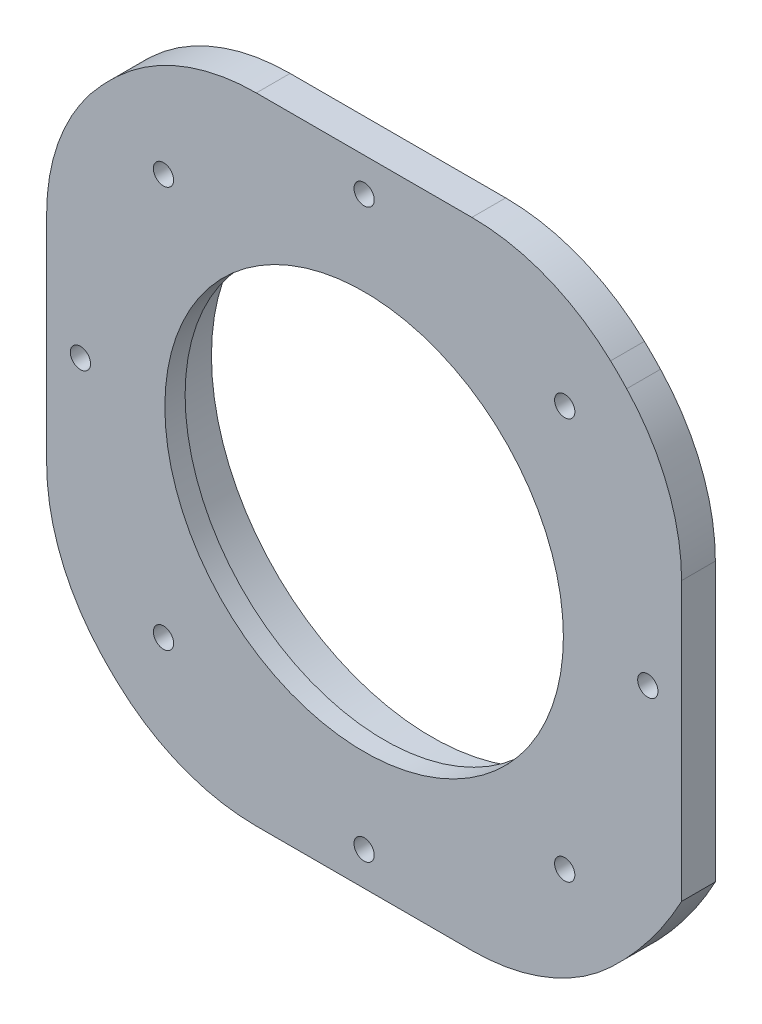
from build123d import *

# Parameters (mm, degrees)
SKETCH1_R               = 36
BOSS_EXTRUDE1_DEPTH     = 5
BOSS_EXTRUDE2_START     = -5
BOSS_EXTRUDE2_DEPTH     = 5
BOSS_EXTRUDE3_START     = -5
BOSS_EXTRUDE3_DEPTH     = 5
BOSS_EXTRUDE4_START     = 5
SKETCH3_R               = 32.7
SKETCH3_R_2             = 32.6
BOSS_EXTRUDE4_DEPTH     = 5
CUT_EXTRUDE1_DEPTH      = 68.216069507
CUT_EXTRUDE1_DEPTH_BACK = 68.216069507
SKETCH4_R               = 32.6
BOSS_EXTRUDE5_START     = -3
SKETCH5_R               = 29.5
BOSS_EXTRUDE5_DEPTH     = 3
CUT_EXTRUDE3_DEPTH      = 68.216069507
CUT_EXTRUDE3_DEPTH_BACK = 68.216069507
SKETCH6_R               = 1.5


with BuildPart() as part:
    # Sketch1 → Boss-Extrude1 (new body)
    # profile 1 of 3: a face of its own
    with BuildSketch(Plane.XY):
        with BuildLine():
            Line((15.957693357, 47), (-15.957693357, 47))
            ThreePointArc((-15.957693357, 47), (-26.99865268, 44.894394011), (-36.489751331, 38.873147815))
            ThreePointArc((-36.489751331, 38.873147815), (-37.700288946, 37.700288946), (-38.873147815, 36.489751331))
            ThreePointArc((-38.873147815, 36.489751331), (-44.894394011, 26.99865268), (-47, 15.957693357))
            Line((-47, 15.957693357), (-47, -15.957693357))
            ThreePointArc((-47, -15.957693357), (-44.894394011, -26.99865268), (-38.873147815, -36.489751331))
            ThreePointArc((-38.873147815, -36.489751331), (-37.700288946, -37.700288946), (-36.489751331, -38.873147815))
            ThreePointArc((-36.489751331, -38.873147815), (-26.99865268, -44.894394011), (-15.957693357, -47))
            Line((-15.957693357, -47), (15.957693357, -47))
            ThreePointArc((15.957693357, -47), (26.99865268, -44.894394011), (36.489751331, -38.873147815))
            ThreePointArc((36.489751331, -38.873147815), (42.303260219, -32.45085127), (47, -25.171880606))
            Line((47, -25.171880606), (47, 15.957693357))
            ThreePointArc((47, 15.957693357), (44.894394011, 26.99865268), (38.873147815, 36.489751331))
            ThreePointArc((38.873147815, 36.489751331), (37.700288946, 37.700288946), (36.489751331, 38.873147815))
            ThreePointArc((36.489751331, 38.873147815), (26.99865268, 44.894394011), (15.957693357, 47))
        make_face()
        Circle(SKETCH1_R, mode=Mode.SUBTRACT)
    # profile 2 of 3: a face of its own
    with BuildSketch(Plane.XY):
        with BuildLine():
            ThreePointArc((35.529282793, -5.802591166), (35.882127728, -2.910826297), (36, 0))
            ThreePointArc((36, 0), (35.999320343, 0.221212273), (35.997281396, 0.442416194))
            ThreePointArc((35.997281396, 0.442416194), (33.655628155, 2.522140659), (35.661160217, 4.927641625))
            ThreePointArc((35.661160217, 4.927641625), (35.097404839, 8.010753622), (34.267618722, 11.03314584))
            ThreePointArc((34.267618722, 11.03314584), (31.416989017, 12.330259572), (32.62438706, 15.220031833))
            ThreePointArc((32.62438706, 15.220031833), (31.176914536, 18), (29.493127743, 20.64353206))
            ThreePointArc((29.493127743, 20.64353206), (26.386812533, 21.042780813), (26.688793942, 24.16005542))
            ThreePointArc((26.688793942, 24.16005542), (24.48621856, 26.389867386), (22.098042936, 28.419649864))
            ThreePointArc((22.098042936, 28.419649864), (19.01205196, 27.885558633), (18.381784361, 30.953352059))
            ThreePointArc((18.381784361, 30.953352059), (15.619814608, 32.434879244), (12.739450039, 33.67055706))
            ThreePointArc((12.739450039, 33.67055706), (9.947987136, 32.250582195), (8.441472573, 34.996307531))
            ThreePointArc((8.441472573, 34.996307531), (5.365521582, 35.597909744), (2.248901099, 35.9296875))
            ThreePointArc((2.248901099, 35.9296875), (0, 33.75), (-2.248901099, 35.9296875))
            ThreePointArc((-2.248901099, 35.9296875), (-5.365521582, 35.597909744), (-8.441472573, 34.996307531))
            ThreePointArc((-8.441472573, 34.996307531), (-9.947987136, 32.250582195), (-12.739450039, 33.67055706))
            ThreePointArc((-12.739450039, 33.67055706), (-15.619814608, 32.434879244), (-18.381784361, 30.953352059))
            ThreePointArc((-18.381784361, 30.953352059), (-19.01205196, 27.885558633), (-22.098042936, 28.419649864))
            ThreePointArc((-22.098042936, 28.419649864), (-24.48621856, 26.389867386), (-26.688793942, 24.16005542))
            ThreePointArc((-26.688793942, 24.16005542), (-26.386812533, 21.042780813), (-29.493127743, 20.64353206))
            ThreePointArc((-29.493127743, 20.64353206), (-31.176914536, 18), (-32.62438706, 15.220031833))
            ThreePointArc((-32.62438706, 15.220031833), (-31.416989017, 12.330259572), (-34.267618722, 11.03314584))
            ThreePointArc((-34.267618722, 11.03314584), (-35.097404839, 8.010753622), (-35.661160217, 4.927641625))
            ThreePointArc((-35.661160217, 4.927641625), (-33.655628155, 2.522140659), (-35.997281396, 0.442416194))
            ThreePointArc((-35.997281396, 0.442416194), (-35.899336699, -2.690283369), (-35.529282793, -5.802591166))
            ThreePointArc((-35.529282793, -5.802591166), (-32.903817036, -7.510081521), (-34.528427647, -10.187624072))
            ThreePointArc((-34.528427647, -10.187624072), (-33.511454951, -13.152276877), (-32.240472674, -16.017238268))
            ThreePointArc((-32.240472674, -16.017238268), (-29.228357378, -16.875), (-29.991571576, -19.912449232))
            ThreePointArc((-29.991571576, -19.912449232), (-28.145933369, -22.445632867), (-26.086955074, -24.808683459))
            ThreePointArc((-26.086955074, -24.808683459), (-22.9558299, -24.740500674), (-22.789832754, -27.867965894))
            ThreePointArc((-22.789832754, -27.867965894), (-20.27952209, -29.744595875), (-17.615497035, -31.395768253))
            ThreePointArc((-17.615497035, -31.395768253), (-14.643576195, -30.407699292), (-13.563117281, -33.347291489))
            ThreePointArc((-13.563117281, -33.347291489), (-10.611186279, -34.400621008), (-7.57882478, -35.19320126))
            ThreePointArc((-7.57882478, -35.19320126), (-5.030176483, -33.373040385), (-3.131259316, -35.863563893))
            ThreePointArc((-3.131259316, -35.863563893), (0, -36), (3.131259316, -35.863563893))
            ThreePointArc((3.131259316, -35.863563893), (5.030176483, -33.373040385), (7.57882478, -35.19320126))
            ThreePointArc((7.57882478, -35.19320126), (10.611186279, -34.400621008), (13.563117281, -33.347291489))
            ThreePointArc((13.563117281, -33.347291489), (14.643576195, -30.407699292), (17.615497035, -31.395768253))
            ThreePointArc((17.615497035, -31.395768253), (20.27952209, -29.744595875), (22.789832754, -27.867965894))
            ThreePointArc((22.789832754, -27.867965894), (22.9558299, -24.740500674), (26.086955074, -24.808683459))
            ThreePointArc((26.086955074, -24.808683459), (28.145933369, -22.445632867), (29.991571576, -19.912449232))
            ThreePointArc((29.991571576, -19.912449232), (29.228357378, -16.875), (32.240472674, -16.017238268))
            ThreePointArc((32.240472674, -16.017238268), (33.511454951, -13.152276877), (34.528427647, -10.187624072))
            ThreePointArc((34.528427647, -10.187624072), (32.903817036, -7.510081521), (35.529282793, -5.802591166))
        make_face()
        with BuildLine():
            ThreePointArc((-32.7, 0), (0, 32.7), (32.7, 0))
            ThreePointArc((32.7, 0), (0, -32.7), (-32.7, 0))
        make_face(mode=Mode.SUBTRACT)
    # profile 3 of 3: a face of its own
    with BuildSketch(Plane.XY):
        with BuildLine():
            ThreePointArc((32.7, 0), (0, 32.7), (-32.7, 0))
            ThreePointArc((-32.7, 0), (0, -32.7), (32.7, 0))
        make_face()
    extrude(amount=BOSS_EXTRUDE1_DEPTH)

    # Sketch1<4> → Boss-Extrude2 (add)
    with BuildSketch(Plane.XY.offset(BOSS_EXTRUDE2_START)):
        with BuildLine():
            ThreePointArc((35.529282793, -5.802591166), (35.882127728, -2.910826297), (36, 0))
            ThreePointArc((36, 0), (35.999320343, 0.221212273), (35.997281396, 0.442416194))
            ThreePointArc((35.997281396, 0.442416194), (33.655628155, 2.522140659), (35.661160217, 4.927641625))
            ThreePointArc((35.661160217, 4.927641625), (35.097404839, 8.010753622), (34.267618722, 11.03314584))
            ThreePointArc((34.267618722, 11.03314584), (31.416989017, 12.330259572), (32.62438706, 15.220031833))
            ThreePointArc((32.62438706, 15.220031833), (31.176914536, 18), (29.493127743, 20.64353206))
            ThreePointArc((29.493127743, 20.64353206), (26.386812533, 21.042780813), (26.688793942, 24.16005542))
            ThreePointArc((26.688793942, 24.16005542), (24.48621856, 26.389867386), (22.098042936, 28.419649864))
            ThreePointArc((22.098042936, 28.419649864), (19.01205196, 27.885558633), (18.381784361, 30.953352059))
            ThreePointArc((18.381784361, 30.953352059), (15.619814608, 32.434879244), (12.739450039, 33.67055706))
            ThreePointArc((12.739450039, 33.67055706), (9.947987136, 32.250582195), (8.441472573, 34.996307531))
            ThreePointArc((8.441472573, 34.996307531), (5.365521582, 35.597909744), (2.248901099, 35.9296875))
            ThreePointArc((2.248901099, 35.9296875), (0, 33.75), (-2.248901099, 35.9296875))
            ThreePointArc((-2.248901099, 35.9296875), (-5.365521582, 35.597909744), (-8.441472573, 34.996307531))
            ThreePointArc((-8.441472573, 34.996307531), (-9.947987136, 32.250582195), (-12.739450039, 33.67055706))
            ThreePointArc((-12.739450039, 33.67055706), (-15.619814608, 32.434879244), (-18.381784361, 30.953352059))
            ThreePointArc((-18.381784361, 30.953352059), (-19.01205196, 27.885558633), (-22.098042936, 28.419649864))
            ThreePointArc((-22.098042936, 28.419649864), (-24.48621856, 26.389867386), (-26.688793942, 24.16005542))
            ThreePointArc((-26.688793942, 24.16005542), (-26.386812533, 21.042780813), (-29.493127743, 20.64353206))
            ThreePointArc((-29.493127743, 20.64353206), (-31.176914536, 18), (-32.62438706, 15.220031833))
            ThreePointArc((-32.62438706, 15.220031833), (-31.416989017, 12.330259572), (-34.267618722, 11.03314584))
            ThreePointArc((-34.267618722, 11.03314584), (-35.097404839, 8.010753622), (-35.661160217, 4.927641625))
            ThreePointArc((-35.661160217, 4.927641625), (-33.655628155, 2.522140659), (-35.997281396, 0.442416194))
            ThreePointArc((-35.997281396, 0.442416194), (-35.899336699, -2.690283369), (-35.529282793, -5.802591166))
            ThreePointArc((-35.529282793, -5.802591166), (-32.903817036, -7.510081521), (-34.528427647, -10.187624072))
            ThreePointArc((-34.528427647, -10.187624072), (-33.511454951, -13.152276877), (-32.240472674, -16.017238268))
            ThreePointArc((-32.240472674, -16.017238268), (-29.228357378, -16.875), (-29.991571576, -19.912449232))
            ThreePointArc((-29.991571576, -19.912449232), (-28.145933369, -22.445632867), (-26.086955074, -24.808683459))
            ThreePointArc((-26.086955074, -24.808683459), (-22.9558299, -24.740500674), (-22.789832754, -27.867965894))
            ThreePointArc((-22.789832754, -27.867965894), (-20.27952209, -29.744595875), (-17.615497035, -31.395768253))
            ThreePointArc((-17.615497035, -31.395768253), (-14.643576195, -30.407699292), (-13.563117281, -33.347291489))
            ThreePointArc((-13.563117281, -33.347291489), (-10.611186279, -34.400621008), (-7.57882478, -35.19320126))
            ThreePointArc((-7.57882478, -35.19320126), (-5.030176483, -33.373040385), (-3.131259316, -35.863563893))
            ThreePointArc((-3.131259316, -35.863563893), (0, -36), (3.131259316, -35.863563893))
            ThreePointArc((3.131259316, -35.863563893), (5.030176483, -33.373040385), (7.57882478, -35.19320126))
            ThreePointArc((7.57882478, -35.19320126), (10.611186279, -34.400621008), (13.563117281, -33.347291489))
            ThreePointArc((13.563117281, -33.347291489), (14.643576195, -30.407699292), (17.615497035, -31.395768253))
            ThreePointArc((17.615497035, -31.395768253), (20.27952209, -29.744595875), (22.789832754, -27.867965894))
            ThreePointArc((22.789832754, -27.867965894), (22.9558299, -24.740500674), (26.086955074, -24.808683459))
            ThreePointArc((26.086955074, -24.808683459), (28.145933369, -22.445632867), (29.991571576, -19.912449232))
            ThreePointArc((29.991571576, -19.912449232), (29.228357378, -16.875), (32.240472674, -16.017238268))
            ThreePointArc((32.240472674, -16.017238268), (33.511454951, -13.152276877), (34.528427647, -10.187624072))
            ThreePointArc((34.528427647, -10.187624072), (32.903817036, -7.510081521), (35.529282793, -5.802591166))
        make_face()
        with BuildLine():
            ThreePointArc((-32.7, 0), (0, 32.7), (32.7, 0))
            ThreePointArc((32.7, 0), (0, -32.7), (-32.7, 0))
        make_face(mode=Mode.SUBTRACT)
    extrude(amount=BOSS_EXTRUDE2_DEPTH)

    # Sketch2 → Boss-Extrude3 (add)
    with BuildSketch(Plane.XY.offset(5).offset(BOSS_EXTRUDE3_START)):
        with BuildLine():
            Line((15.957693357, 47), (-15.957693357, 47))
            ThreePointArc((-15.957693357, 47), (-26.99865268, 44.894394011), (-36.489751331, 38.873147815))
            ThreePointArc((-36.489751331, 38.873147815), (-37.700288946, 37.700288946), (-38.873147815, 36.489751331))
            ThreePointArc((-38.873147815, 36.489751331), (-44.894394011, 26.99865268), (-47, 15.957693357))
            Line((-47, 15.957693357), (-47, -15.957693357))
            ThreePointArc((-47, -15.957693357), (-44.894394011, -26.99865268), (-38.873147815, -36.489751331))
            ThreePointArc((-38.873147815, -36.489751331), (-37.700288946, -37.700288946), (-36.489751331, -38.873147815))
            ThreePointArc((-36.489751331, -38.873147815), (-26.99865268, -44.894394011), (-15.957693357, -47))
            Line((-15.957693357, -47), (15.957693357, -47))
            ThreePointArc((15.957693357, -47), (26.99865268, -44.894394011), (36.489751331, -38.873147815))
            ThreePointArc((36.489751331, -38.873147815), (42.303260219, -32.45085127), (47, -25.171880606))
            Line((47, -25.171880606), (47, 15.957693357))
            ThreePointArc((47, 15.957693357), (44.894394011, 26.99865268), (38.873147815, 36.489751331))
            ThreePointArc((38.873147815, 36.489751331), (37.700288946, 37.700288946), (36.489751331, 38.873147815))
            ThreePointArc((36.489751331, 38.873147815), (26.99865268, 44.894394011), (15.957693357, 47))
        make_face()
    extrude(amount=BOSS_EXTRUDE3_DEPTH)

    # Sketch3 → Boss-Extrude4 (add)
    with BuildSketch(Plane(origin=(0, 0, 0), x_dir=(-1, 0, 0), z_dir=(0, 0, -1)).offset(BOSS_EXTRUDE4_START)):
        Circle(SKETCH3_R)
        with Locations(Location((0, 0, 0), (0, 0, 180))):
            Circle(SKETCH3_R_2, mode=Mode.SUBTRACT)
    extrude(amount=-BOSS_EXTRUDE4_DEPTH)

    # Sketch4 → Cut-Extrude1 (cut, two sides: drawn at the far end of the back side and taken through both)
    with BuildSketch(Plane.XY.offset(5).offset(-CUT_EXTRUDE1_DEPTH_BACK)):
        Circle(SKETCH4_R)
    extrude(amount=CUT_EXTRUDE1_DEPTH + CUT_EXTRUDE1_DEPTH_BACK, mode=Mode.SUBTRACT)

    # Sketch5 → Boss-Extrude5 (add)
    with BuildSketch(Plane.XY.offset(5).offset(BOSS_EXTRUDE5_START)):
        with BuildLine():
            Line((15.957693357, 47), (-15.957693357, 47))
            ThreePointArc((-15.957693357, 47), (-26.99865268, 44.894394011), (-36.489751331, 38.873147815))
            ThreePointArc((-36.489751331, 38.873147815), (-37.700288946, 37.700288946), (-38.873147815, 36.489751331))
            ThreePointArc((-38.873147815, 36.489751331), (-44.894394011, 26.99865268), (-47, 15.957693357))
            Line((-47, 15.957693357), (-47, -15.957693357))
            ThreePointArc((-47, -15.957693357), (-44.894394011, -26.99865268), (-38.873147815, -36.489751331))
            ThreePointArc((-38.873147815, -36.489751331), (-37.700288946, -37.700288946), (-36.489751331, -38.873147815))
            ThreePointArc((-36.489751331, -38.873147815), (-26.99865268, -44.894394011), (-15.957693357, -47))
            Line((-15.957693357, -47), (15.957693357, -47))
            ThreePointArc((15.957693357, -47), (26.99865268, -44.894394011), (36.489751331, -38.873147815))
            ThreePointArc((36.489751331, -38.873147815), (42.303260219, -32.45085127), (47, -25.171880606))
            Line((47, -25.171880606), (47, 15.957693357))
            ThreePointArc((47, 15.957693357), (44.894394011, 26.99865268), (38.873147815, 36.489751331))
            ThreePointArc((38.873147815, 36.489751331), (37.700288946, 37.700288946), (36.489751331, 38.873147815))
            ThreePointArc((36.489751331, 38.873147815), (26.99865268, 44.894394011), (15.957693357, 47))
        make_face()
        Circle(SKETCH5_R, mode=Mode.SUBTRACT)
    extrude(amount=BOSS_EXTRUDE5_DEPTH)

    # Sketch6 → Cut-Extrude3 (cut, two sides: drawn at the far end of the back side and taken through both)
    with BuildSketch(Plane.XY.offset(5).offset(-CUT_EXTRUDE3_DEPTH_BACK)):
        with Locations((42, 0)):
            Circle(SKETCH6_R)
        with Locations((29.69848481, -29.69848481)):
            Circle(SKETCH6_R)
        with Locations((0, -42)):
            Circle(SKETCH6_R)
        with Locations((-29.69848481, -29.69848481)):
            Circle(SKETCH6_R)
        with Locations((-42, 0)):
            Circle(SKETCH6_R)
        with Locations((-29.69848481, 29.69848481)):
            Circle(SKETCH6_R)
        with Locations((0, 42)):
            Circle(SKETCH6_R)
        with Locations((29.69848481, 29.69848481)):
            Circle(SKETCH6_R)
    extrude(amount=CUT_EXTRUDE3_DEPTH + CUT_EXTRUDE3_DEPTH_BACK, mode=Mode.SUBTRACT)


solid = part.part
